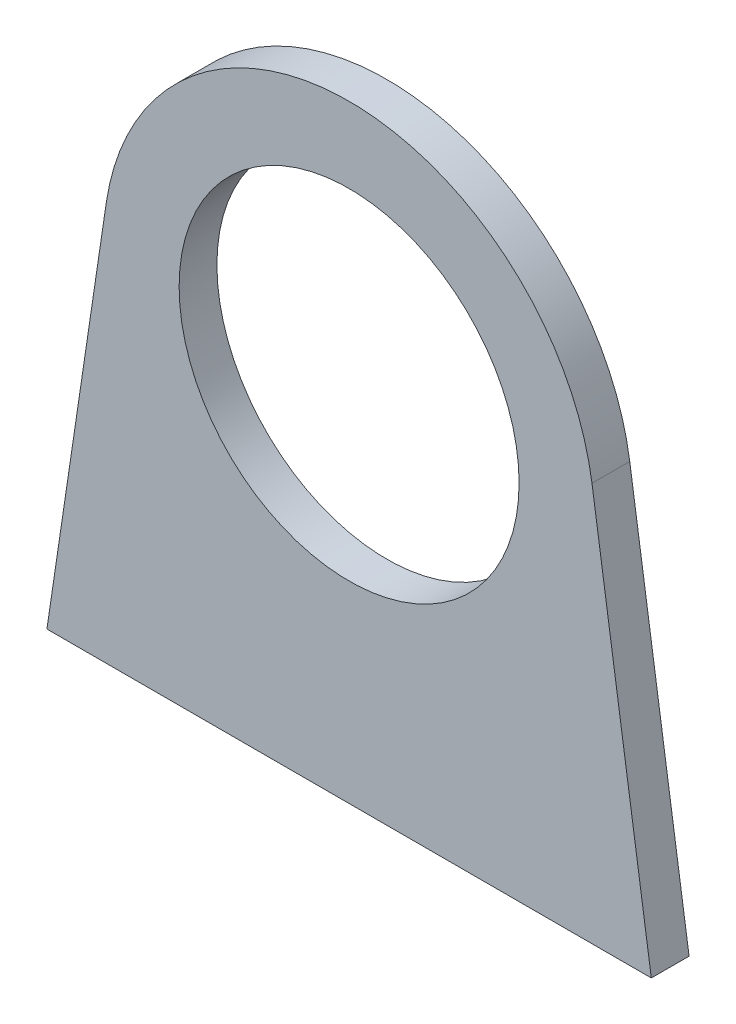
from build123d import *

# Parameters (mm, degrees)
SKETCH1_R           = 14.2875
BOSS_EXTRUDE1_DEPTH = 3.175


with BuildPart() as part:
    # Sketch1 → Boss-Extrude1 (new body)
    with BuildSketch(Plane.XY):
        with BuildLine():
            Line((-25.4, -30.48), (25.4, -30.48))
            Line((25.4, -30.48), (20.412766231, 3.037331235))
            ThreePointArc((20.412766231, 3.037331235), (0, 20.6375), (-20.412766231, 3.037331235))
            Line((-20.412766231, 3.037331235), (-25.4, -30.48))
        make_face()
        Circle(SKETCH1_R, mode=Mode.SUBTRACT)
    extrude(amount=BOSS_EXTRUDE1_DEPTH)


solid = part.part
